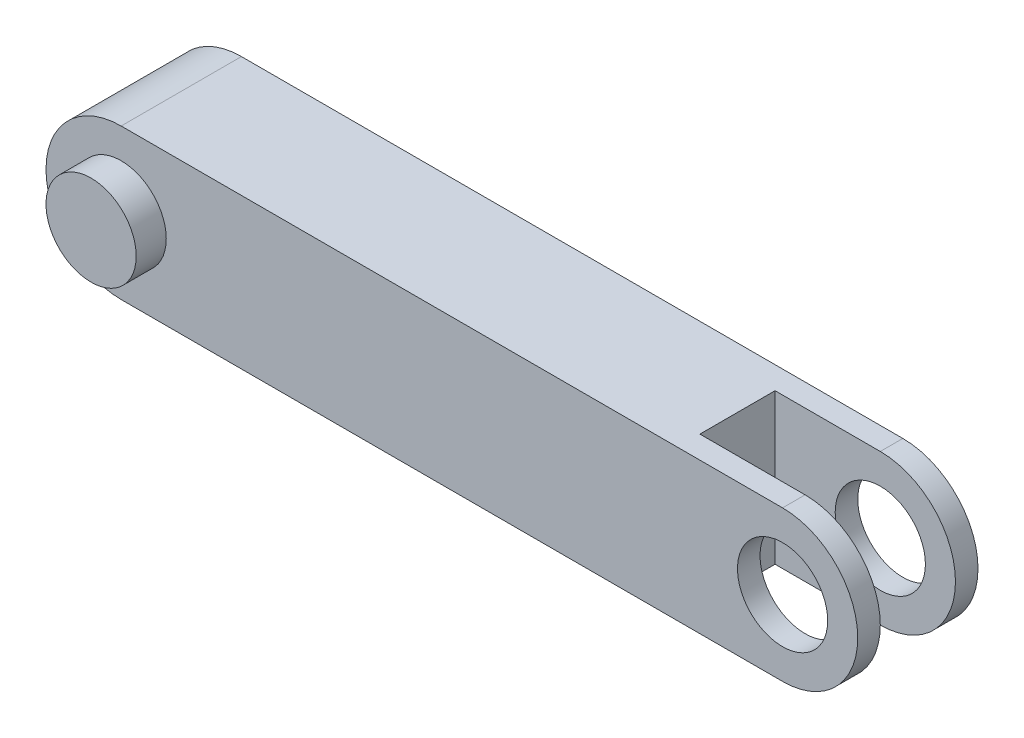
from build123d import *

# Parameters (mm, degrees)
BOSS_EXTRUDE1_DEPTH = 40
SKETCH3_R           = 15
BOSS_EXTRUDE2_DEPTH = 10
BOSS_EXTRUDE3_START = 10
SKETCH4_R           = 15
BOSS_EXTRUDE3_DEPTH = 10
SKETCH5_W           = 60
SKETCH5_H           = 25
CUT_EXTRUDE1_DEPTH  = 203.25937939
SKETCH6_R           = 15
CUT_EXTRUDE2_DEPTH  = 198.569877641


with BuildPart() as part:
    # Sketch1 → Boss-Extrude1 (new body)
    with BuildSketch(Plane.XY):
        with BuildLine():
            Line((-55.503676682, 25), (164.496323318, 25))
            ThreePointArc((164.496323318, 25), (189.496323318, 0), (164.496323318, -25))
            Line((164.496323318, -25), (-55.503676682, -25))
            ThreePointArc((-55.503676682, -25), (-80.503676682, 0), (-55.503676682, 25))
        make_face()
    extrude(amount=BOSS_EXTRUDE1_DEPTH)

    # Sketch3 → Boss-Extrude2 (add)
    with BuildSketch(Plane.XY.offset(40)):
        with Locations((-55.503676682, 0)):
            Circle(SKETCH3_R)
    extrude(amount=BOSS_EXTRUDE2_DEPTH)

    # Sketch4 → Boss-Extrude3 (add)
    with BuildSketch(Plane(origin=(0, 0, 0), x_dir=(-1, 0, 0), z_dir=(0, 0, -1)).offset(BOSS_EXTRUDE3_START)):
        with Locations(Location((55.503676682, 0, 0), (0, 0, 180))):
            Circle(SKETCH4_R)
    extrude(amount=-BOSS_EXTRUDE3_DEPTH)

    # Sketch5 → Cut-Extrude1 (cut, through all)
    with BuildSketch(Plane(origin=(0, 25, 0), x_dir=(1, 0, 0), z_dir=(0, 1, 0))):
        with Locations((159.496323318, -20)):
            Rectangle(SKETCH5_W, SKETCH5_H)
    extrude(amount=-CUT_EXTRUDE1_DEPTH, mode=Mode.SUBTRACT)

    # Sketch6 → Cut-Extrude2 (cut, through all)
    with BuildSketch(Plane.XY.offset(40)):
        with Locations((164.496323318, 0)):
            Circle(SKETCH6_R)
    extrude(amount=-CUT_EXTRUDE2_DEPTH, mode=Mode.SUBTRACT)


solid = part.part
